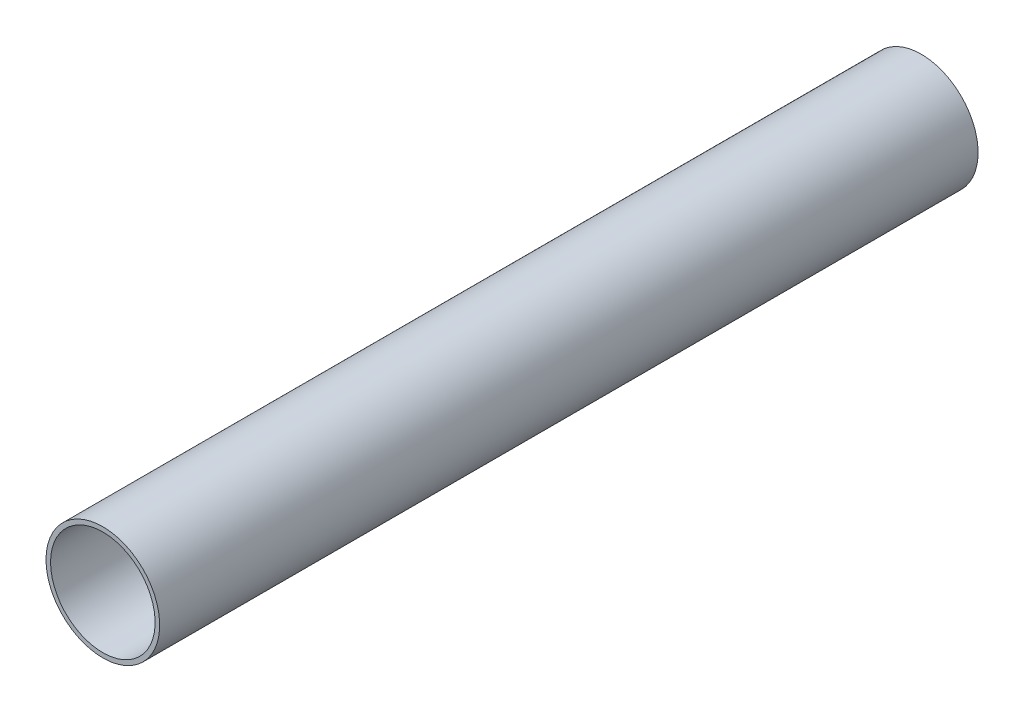
from build123d import *

# Parameters (mm, degrees)
SKETCH_1_R      = 12.5
SKETCH_1_R_2    = 11.5
EXTRUDE_1_DEPTH = 180


with BuildPart() as part:
    # 草图1 → 凸台-拉伸1 (new body)
    with BuildSketch(Plane.XY):
        with Locations(Location((0, 0, 0), (0, 0, 180))):
            Circle(SKETCH_1_R)
        with Locations(Location((0, 0, 0), (0, 0, 180))):
            Circle(SKETCH_1_R_2, mode=Mode.SUBTRACT)
    extrude(amount=EXTRUDE_1_DEPTH)


solid = part.part
